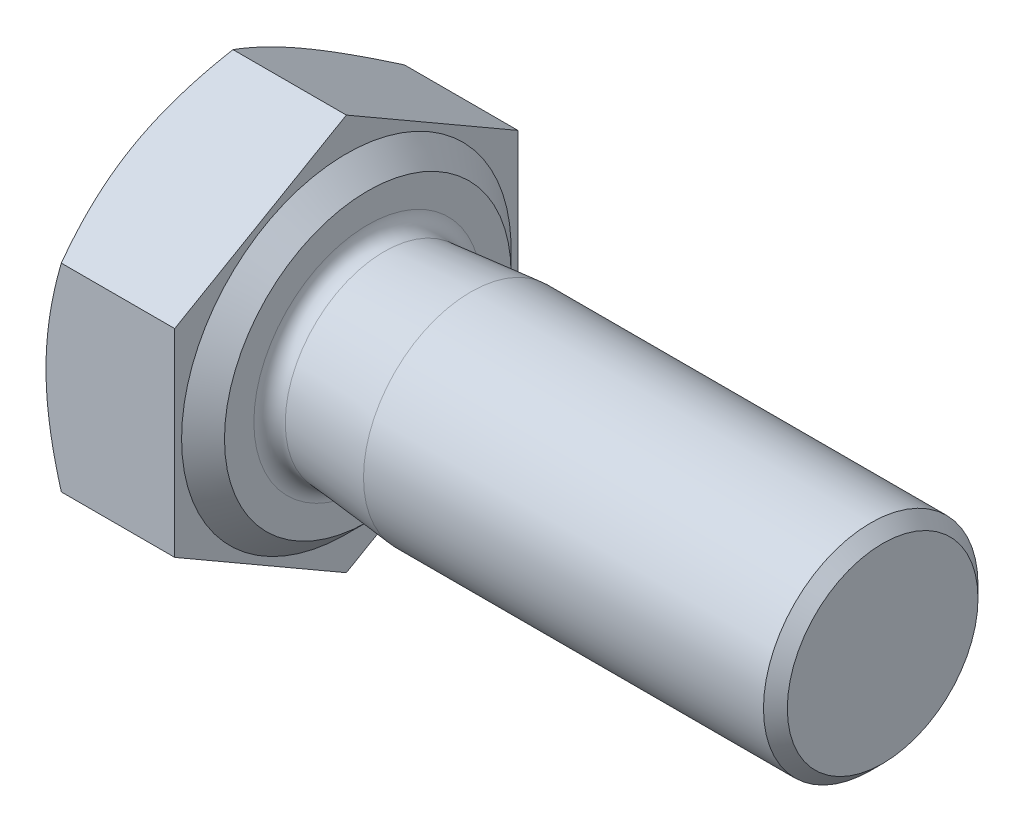
from build123d import *

# Parameters (mm, degrees)
EXTRUDE_1_DEPTH     = 3.5
SKETCH_4_R          = 8.79
SKETCH_4_R_2        = 4
CUT_EXTRUDE_1_DEPTH = 0.4375
CUT_EXTRUDE_1_DRAFT = -60
CHAMFER_1_SIZE      = 0.277777778


with BuildPart() as part:
    # 草图3 → 凸台-拉伸1 (new body)
    with BuildSketch(Plane(origin=(0, 0, 0), x_dir=(0, 0, -1), z_dir=(1, 0, 0))):
        Polygon((4, 2.309401077), (0, 4.618802154), (-4, 2.309401077), (-4, -2.309401077), (0, -4.618802154), (4, -2.309401077), align=None)
    extrude(amount=EXTRUDE_1_DEPTH)


with BuildPart() as cut_extrude_1_tool:
    # 草图4 → 切除-拉伸1 (with draft: the straight prism first)
    with BuildSketch(Plane.ZY):
        Circle(SKETCH_4_R)
        Circle(SKETCH_4_R_2, mode=Mode.SUBTRACT)
    extrude(amount=-CUT_EXTRUDE_1_DEPTH)
    # 切除-拉伸1: the draft: its side faces are tilted about the plane it starts from
    cut_extrude_1_sides = [cut_extrude_1_tool.faces().sort_by_distance(p)[0] for p in [
        (0.21875, 0, -8.79),
        (0.21875, 0, -4),
    ]]
    draft(cut_extrude_1_sides, Plane.ZY, CUT_EXTRUDE_1_DRAFT)


with BuildPart() as part_1:
    add(part.part)

    # 切除-拉伸1: cut by cut_extrude_1_tool
    add(cut_extrude_1_tool.part, mode=Mode.SUBTRACT)

    # 草图6 → 旋转2 (revolve)
    with BuildSketch(Plane.XY, mode=Mode.PRIVATE) as revolve_2_sk:
        with BuildLine():
            Line((5.9, 2.5), (15.5, 2.5))
            Line((15.5, 2.5), (15.5, 0))
            Line((15.5, 0), (3.5, 0))
            Line((3.5, 0), (3.5, 2.65515))
            ThreePointArc((3.5, 2.65515), (3.614612825, 2.396127071), (3.883387874, 2.30674614))
            Line((3.883387874, 2.30674614), (5.9, 2.5))
        make_face()
    revolve(revolve_2_sk.sketch.rotate(Axis((3.5, 0, 0), (1, 0, 0)), 90), axis=Axis((3.5, 0, 0), (1, 0, 0)))

    # 倒角1
    chamfer_1_edges = [part_1.edges().sort_by_distance(p)[0] for p in [
        (15.5, 0, -2.5),
    ]]
    chamfer(chamfer_1_edges, length=CHAMFER_1_SIZE)

    # 草图8 → 切除-旋转2 (revolve, cut)
    with BuildSketch(Plane.XY, mode=Mode.PRIVATE) as cut_revolve_2_sk:
        Polygon((3.5, 3.34), (3, 3.84), (3, 8.79), (3.5, 8.79), align=None)
    revolve(cut_revolve_2_sk.sketch.rotate(Axis((0, 0, 0), (1, 0, 0)), 90), axis=Axis((0, 0, 0), (1, 0, 0)), mode=Mode.SUBTRACT)


solid = part_1.part
